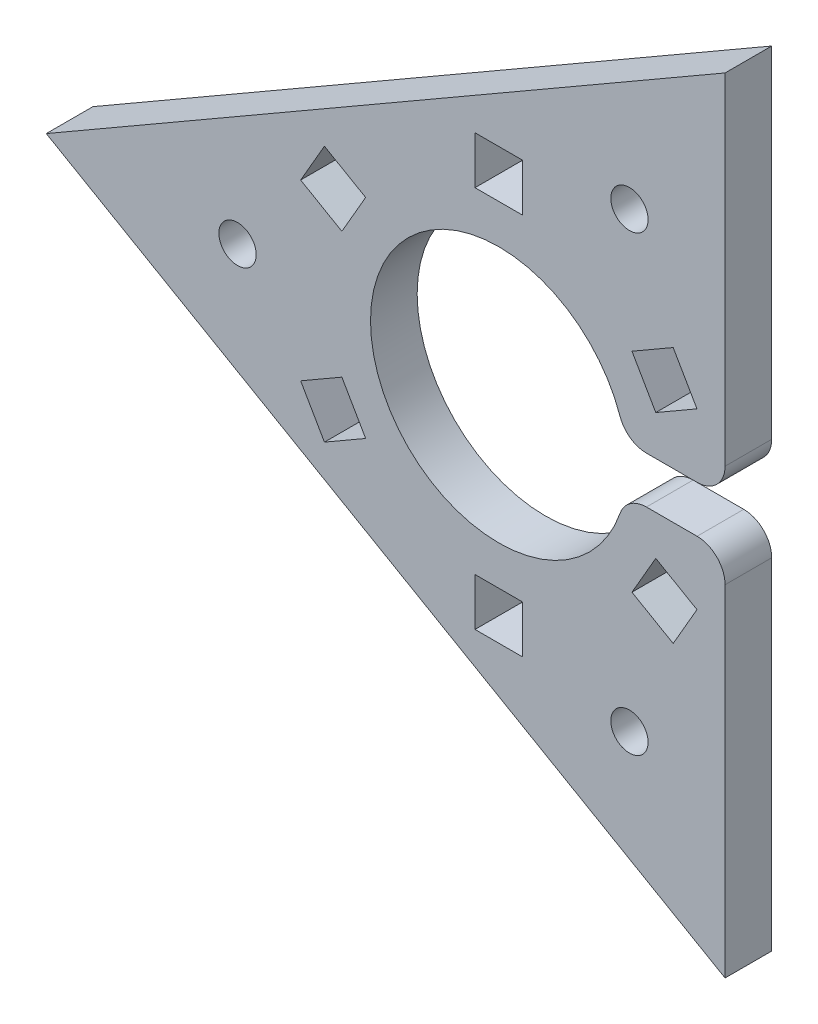
from build123d import *

# Parameters (mm, degrees)
SKETCH1_R           = 2
SKETCH1_W           = 5.1
SKETCH1_H           = 5.1
BOSS_EXTRUDE1_DEPTH = 5
CONG_2_R            = 3


with BuildPart() as part:
    # Sketch1 → Boss-Extrude1 (new body)
    with BuildSketch(Plane.XY):
        with BuildLine():
            Line((24.248711306, 2.5), (13.520817283, 2.5))
            ThreePointArc((13.520817283, 2.5), (-13.75, 0), (13.520817283, -2.5))
            Line((13.520817283, -2.5), (24.248711306, -2.5))
            Line((24.248711306, -2.5), (24.248711306, -42))
            Line((24.248711306, -42), (-48.497422612, 0))
            Line((-48.497422612, 0), (24.248711306, 42))
            Line((24.248711306, 42), (24.248711306, 2.5))
        make_face()
        with Locations((14, 24.248711306)):
            Circle(SKETCH1_R, mode=Mode.SUBTRACT)
        with Locations((14, -24.248711306)):
            Circle(SKETCH1_R, mode=Mode.SUBTRACT)
        with Locations((-28, 0)):
            Circle(SKETCH1_R, mode=Mode.SUBTRACT)
        with Locations((0, 20.5)):
            Rectangle(SKETCH1_W, SKETCH1_H, mode=Mode.SUBTRACT)
        Polygon((21.236885557, 9.31663522), (16.820155998, 6.76663522), (14.270155998, 11.18336478), (18.686885557, 13.73336478), align=None, mode=Mode.SUBTRACT)
        Polygon((18.686885557, -13.73336478), (14.270155998, -11.18336478), (16.820155998, -6.76663522), (21.236885557, -9.31663522), align=None, mode=Mode.SUBTRACT)
        with Locations((0, -20.5)):
            Rectangle(SKETCH1_W, SKETCH1_H, mode=Mode.SUBTRACT)
        Polygon((-21.236885557, -9.31663522), (-16.820155998, -6.76663522), (-14.270155998, -11.18336478), (-18.686885557, -13.73336478), align=None, mode=Mode.SUBTRACT)
        Polygon((-18.686885557, 13.73336478), (-14.270155998, 11.18336478), (-16.820155998, 6.76663522), (-21.236885557, 9.31663522), align=None, mode=Mode.SUBTRACT)
    extrude(amount=BOSS_EXTRUDE1_DEPTH)

    # Congé2
    cong_2_edges = [part.edges().sort_by_distance(p)[0] for p in [
        (24.248711306, 2.5, 2.5),
        (13.520817283, 2.5, 2.5),
        (13.520817283, -2.5, 2.5),
        (24.248711306, -2.5, 2.5),
    ]]
    fillet(cong_2_edges, radius=CONG_2_R)


solid = part.part
